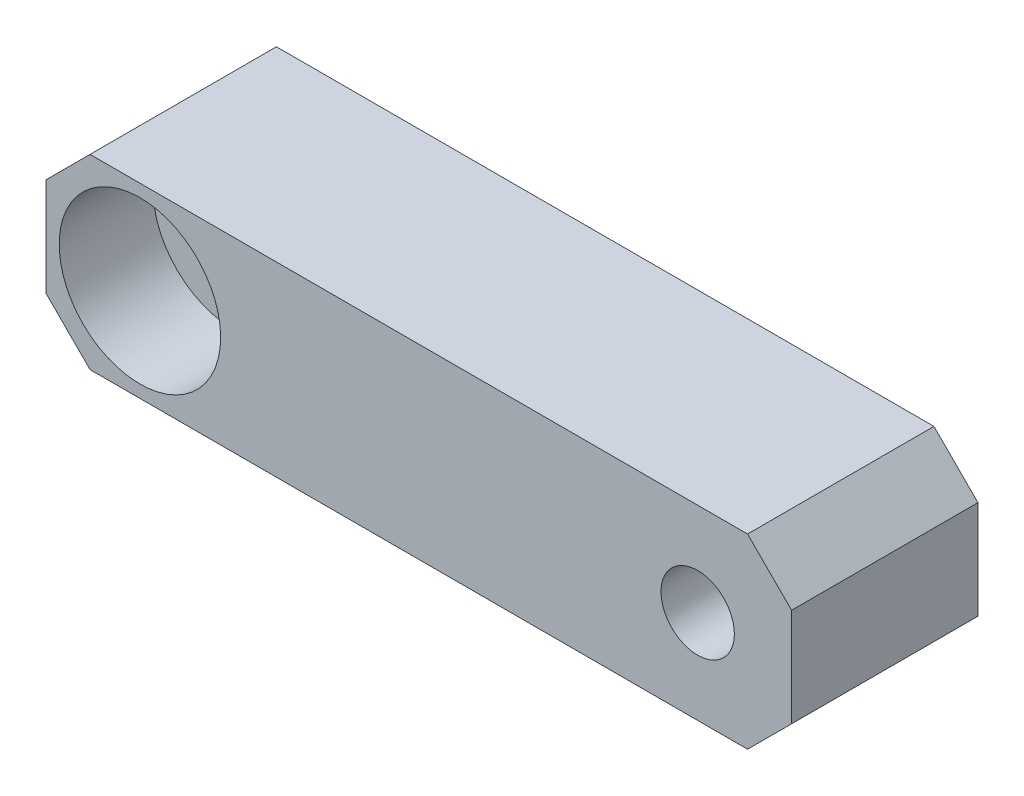
from build123d import *

# Parameters (mm, degrees)
SALIENTE_EXTRUIR1_DEPTH                              = 6.35
TALADRO_ROSCADO_M61_D                                = 5
REFRENTADO_PARA_TORNILLO_CON_CABEZA_HUEC_D           = 6.6
REFRENTADO_PARA_TORNILLO_CON_CABEZA_HUEC_CBORE_D     = 11
REFRENTADO_PARA_TORNILLO_CON_CABEZA_HUEC_CBORE_DEPTH = 6.4


with BuildPart() as part:
    # Croquis1 → Saliente-Extruir1 (new, symmetric)
    with BuildSketch(Plane.XY):
        Polygon((-22.4, 6.35), (-25.4, 3.35), (-25.4, -3.35), (-22.4, -6.35), (22.4, -6.35), (25.4, -3.35), (25.4, 3.35), (22.4, 6.35), align=None)
    extrude(amount=SALIENTE_EXTRUIR1_DEPTH, both=True)

    # Taladro roscado M61 (through all)
    with Locations(Plane.XY.offset(6.35)):
        with Locations((19, 0)):
            Hole(TALADRO_ROSCADO_M61_D / 2)

    # Refrentado para tornillo con cabeza huec (through all)
    with Locations(Plane.XY.offset(6.35)):
        with Locations((-19, 0)):
            CounterBoreHole(REFRENTADO_PARA_TORNILLO_CON_CABEZA_HUEC_D / 2, REFRENTADO_PARA_TORNILLO_CON_CABEZA_HUEC_CBORE_D / 2, REFRENTADO_PARA_TORNILLO_CON_CABEZA_HUEC_CBORE_DEPTH)


solid = part.part
